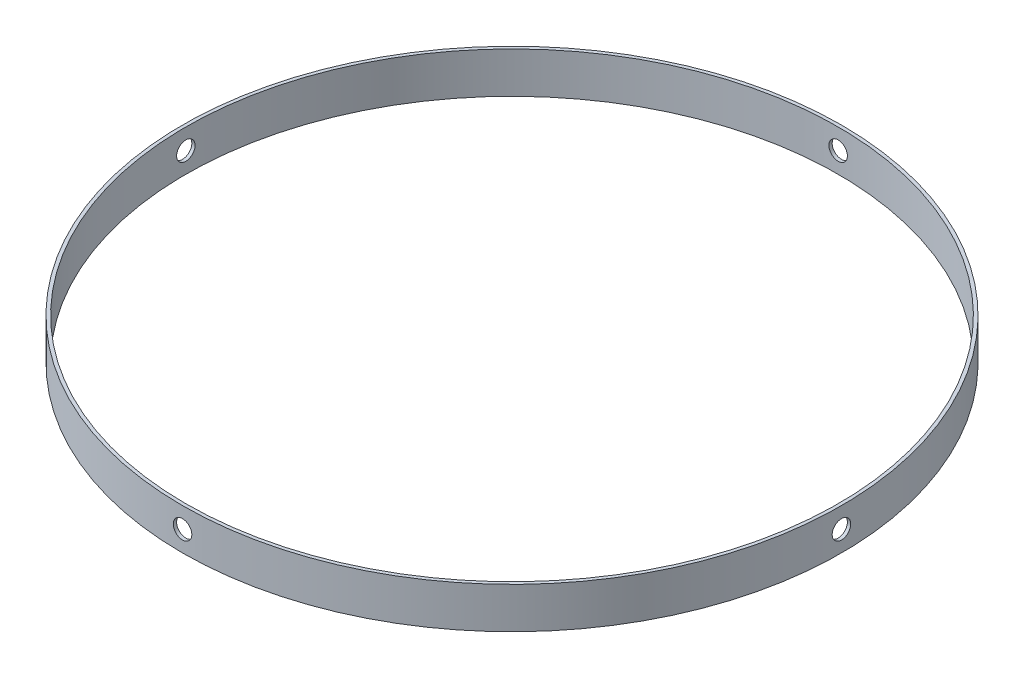
from build123d import *

# Parameters (mm, degrees)
SKETCH1_R           = 80.3
SKETCH1_R_2         = 79.5
BOSS_EXTRUDE1_DEPTH = 5
SKETCH2_R           = 2.2499955
CUT_EXTRUDE3_DEPTH  = 114.671368427
CIRPATTERN1_COUNT   = 4


with BuildPart() as part:
    # Sketch1 → Boss-Extrude1 (new, symmetric)
    with BuildSketch(Plane(origin=(0, 0, 0), x_dir=(1, 0, 0), z_dir=(0, 1, 0))):
        with Locations(Location((0, 0, 0), (0, 0, 270))):
            Circle(SKETCH1_R)
        with Locations(Location((0, 0, 0), (0, 0, 270))):
            Circle(SKETCH1_R_2, mode=Mode.SUBTRACT)
    extrude(amount=BOSS_EXTRUDE1_DEPTH, both=True)

    # Sketch2 → Cut-Extrude3 (cut, through all)
    with BuildSketch(Plane.XY):
        with Locations(Location((0, 0, 0), (0, 0, 90))):
            Circle(SKETCH2_R)
    cut_extrude3 = extrude(amount=-CUT_EXTRUDE3_DEPTH, mode=Mode.SUBTRACT)

    # CirPattern1: Cut-Extrude3 ×4 about axis
    cirpattern1_axis = Axis((0, 5, 0), (0, -1, 0))
    for i in range(1, CIRPATTERN1_COUNT):
        add(cut_extrude3.rotate(cirpattern1_axis, i * 360 / CIRPATTERN1_COUNT), mode=Mode.SUBTRACT)


solid = part.part
